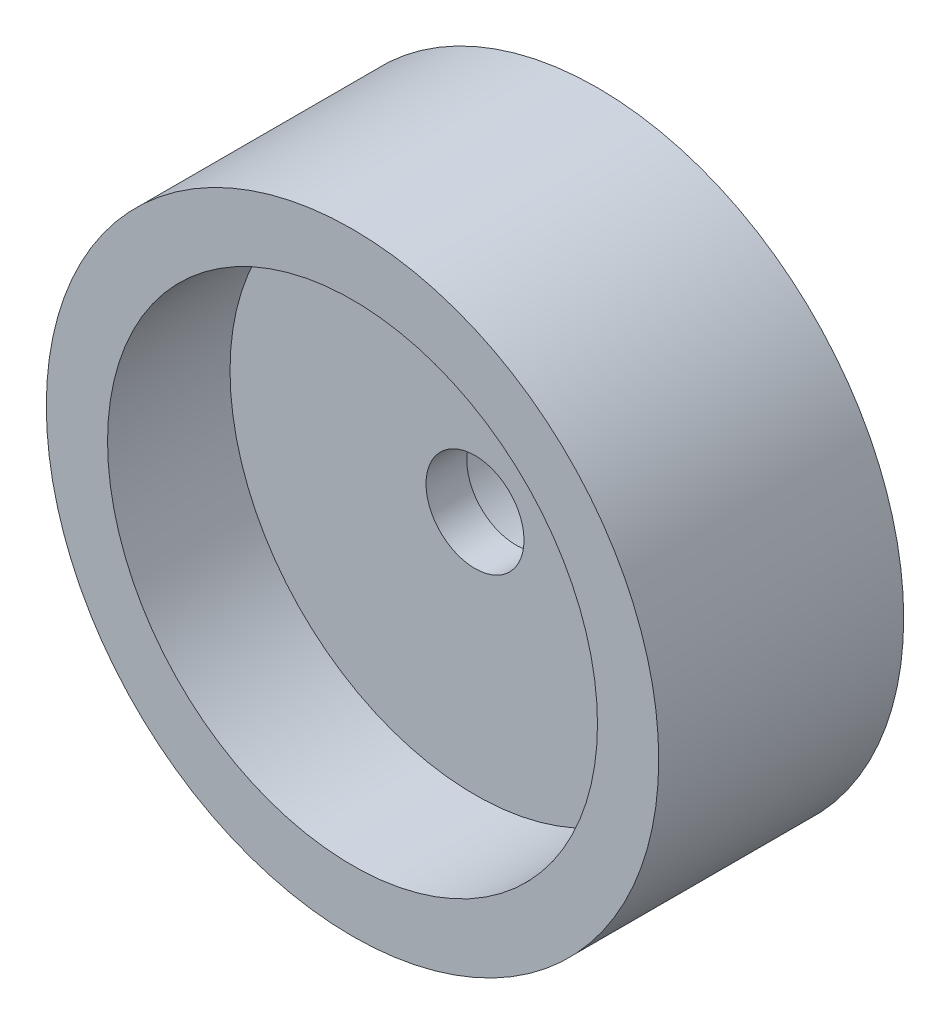
from build123d import *

# Parameters (mm, degrees)
SKETCH_1_R          = 7.5
EXTRUDE_1_DEPTH     = 6
SKETCH_2_R          = 6
CUT_EXTRUDE_1_DEPTH = 3


with BuildPart() as part:
    # 스케치1 → 보스-돌출1 (new body)
    with BuildSketch(Plane.XY):
        Circle(SKETCH_1_R)
    extrude(amount=EXTRUDE_1_DEPTH)

    # 스케치2 → 컷-돌출1 (cut)
    with BuildSketch(Plane.XY.offset(6)):
        Circle(SKETCH_2_R)
    extrude(amount=-CUT_EXTRUDE_1_DEPTH, mode=Mode.SUBTRACT)

    # 스케치8 → M2 소켓 머리 캡 나사용 카운터보어2 (revolve, cut)
    with BuildSketch(Plane.YZ):
        Polygon((0, 0), (0, 5.721032743), (1.2, 5), (1.2, 2), (2.25, 2), (2.25, 0.025), (2.275, 0), align=None)
    revolve(axis=Axis((0, 0, -6.35), (0, 0, 1)), mode=Mode.SUBTRACT)


solid = part.part
